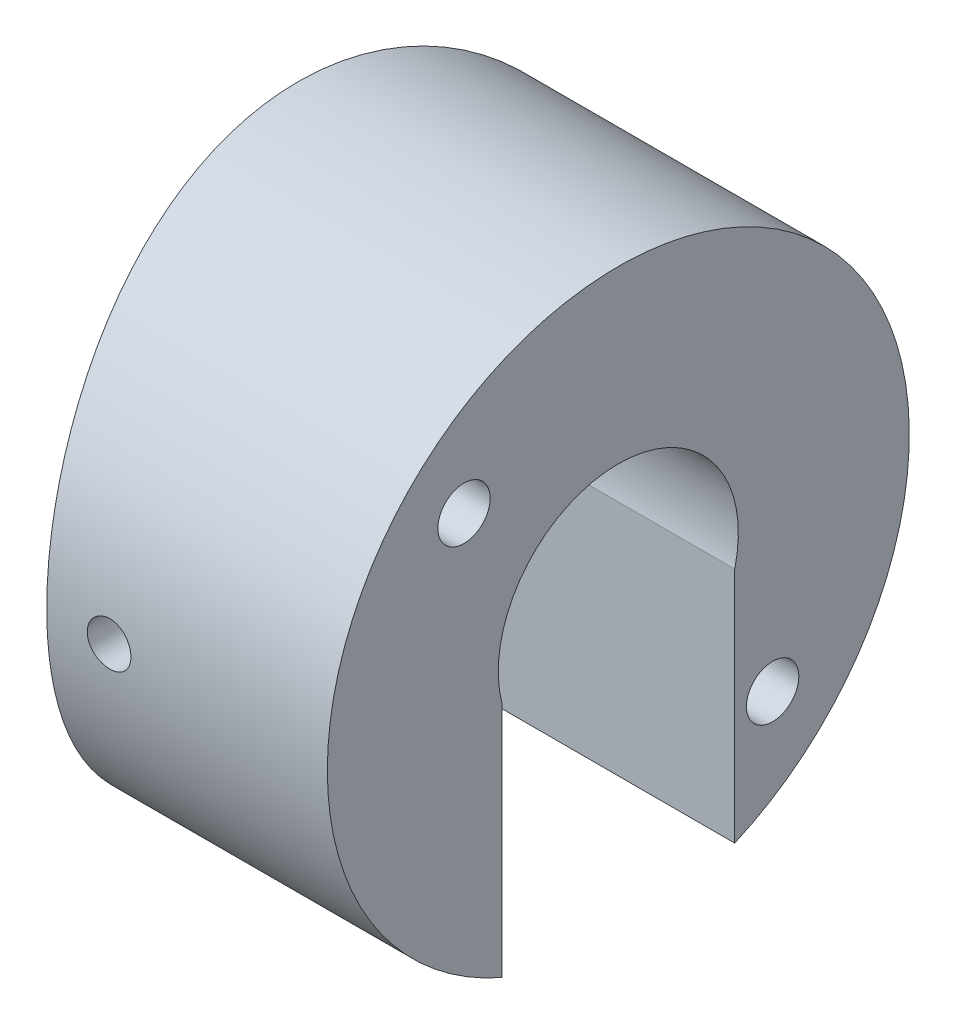
from build123d import *

# Parameters (mm, degrees)
SKETCH1_R                               = 20
BLOCO_DEPTH                             = 22
ENCAIXE_START                           = -18
ENCAIXE_DO_POTENCI_METRO_DEPTH          = 18
FURO_DE_FIXA_O_PARAFUSO_M3_D            = 3.6
FURO_DE_FIXA_O_PARAFUSO_M3_CBORE_D      = 6.5
FURO_DE_FIXA_O_PARAFUSO_M3_CBORE_DEPTH  = 3
CORTE_ARREDONDAMENTO_DEPTH              = 36.832945734
CORTE_ARREDONDAMENTO_DEPTH_BACK         = 36.832945734
SKETCH7_R                               = 100
SKETCH7_R_2                             = 75
FURO_DE_FIXA_O_POTENCI_METRO_REACH      = 37.833
FURO_DE_FIXA_O_POTENCI_METRO_END_RADIUS = 20
SKETCH8_R                               = 1.5


with BuildPart() as part:
    # Sketch1 → Bloco (new body)
    with BuildSketch(Plane(origin=(0, 0, 0), x_dir=(0, 0, -1), z_dir=(1, 0, 0))):
        Circle(SKETCH1_R)
    extrude(amount=BLOCO_DEPTH)

    # Sketch2 → Encaixe do Potenciômetro (cut)
    with BuildSketch(Plane(origin=(22, 0, 0), x_dir=(0, 0, -1), z_dir=(1, 0, 0)).offset(ENCAIXE_START)):
        with BuildLine():
            Line((-8, -18.33030278), (-8, -2.015564437))
            ThreePointArc((-8, -2.015564437), (0, 8.25), (8, -2.015564437))
            Line((8, -2.015564437), (8, -18.33030278))
            ThreePointArc((8, -18.33030278), (0, -20), (-8, -18.33030278))
        make_face()
    extrude(amount=ENCAIXE_DO_POTENCI_METRO_DEPTH, mode=Mode.SUBTRACT)

    # Furo de Fixação - Parafuso M3 (through all)
    with Locations(Plane.ZY):
        with Locations((10.606601718, 10.606601718), (-10.606601718, -10.606601718)):
            CounterBoreHole(FURO_DE_FIXA_O_PARAFUSO_M3_D / 2, FURO_DE_FIXA_O_PARAFUSO_M3_CBORE_D / 2, FURO_DE_FIXA_O_PARAFUSO_M3_CBORE_DEPTH)

    # Sketch7 → Corte - Arredondamento (cut, two sides: drawn at the far end of the back side and taken through both)
    with BuildSketch(Plane(origin=(0, 0, 0), x_dir=(1, 0, 0), z_dir=(0, 1, 0)).offset(-CORTE_ARREDONDAMENTO_DEPTH_BACK)):
        with Locations((75, 0)):
            Circle(SKETCH7_R)
        with Locations((75, 0)):
            Circle(SKETCH7_R_2, mode=Mode.SUBTRACT)
    extrude(amount=CORTE_ARREDONDAMENTO_DEPTH + CORTE_ARREDONDAMENTO_DEPTH_BACK, mode=Mode.SUBTRACT)

    # Furo de Fixação - Potenciômetro: up to this cylinder (the profile starts inside it)
    furo_de_fixa_o_potenci_metro_end = Plane(origin=(7, 0, 0), z_dir=(-1, 0, 0)) * Cylinder(FURO_DE_FIXA_O_POTENCI_METRO_END_RADIUS, 116.666, mode=Mode.PRIVATE)
    # Sketch8 → Furo de Fixação - Potenciômetro (cut, up to the surface)
    with BuildSketch(Plane.XY, mode=Mode.PRIVATE) as furo_de_fixa_o_potenci_metro_sk1:
        with Locations(Location((7, 0, 0), (0, 0, 180))):
            Circle(SKETCH8_R)
    furo_de_fixa_o_potenci_metro_tool1 = extrude(furo_de_fixa_o_potenci_metro_sk1.sketch, amount=FURO_DE_FIXA_O_POTENCI_METRO_REACH, mode=Mode.PRIVATE) & furo_de_fixa_o_potenci_metro_end
    add(furo_de_fixa_o_potenci_metro_tool1.solids().sort_by_distance((7, 0, 0))[0], mode=Mode.SUBTRACT)


solid = part.part
